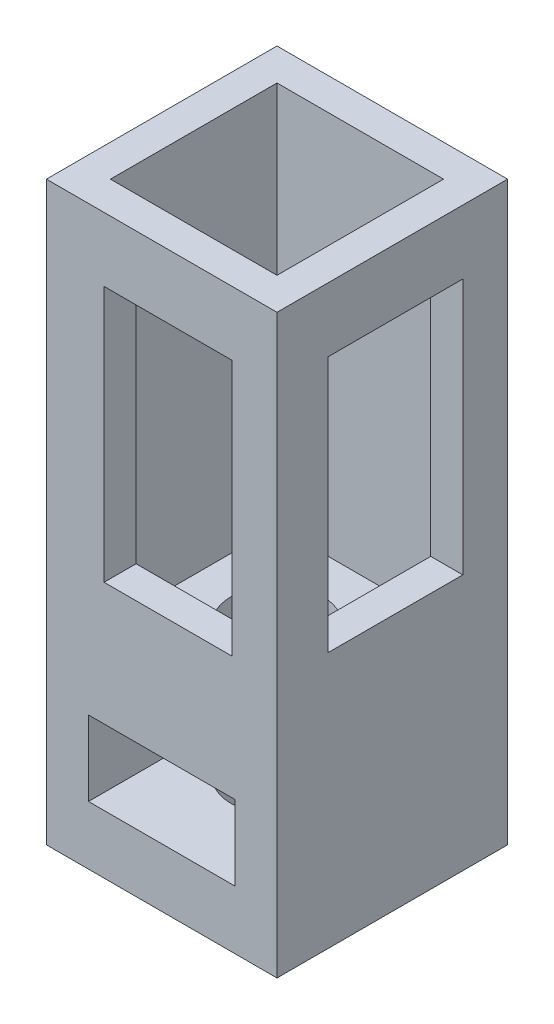
from build123d import *

# Parameters (mm, degrees)
SKETCH1_W                   = 18
SKETCH1_H                   = 18
BOSS_EXTRUDE1_DEPTH         = 35
SKETCH5_W                   = 13
SKETCH5_H                   = 13
CUT_EXTRUDE1_DEPTH          = 30
CUT_EXTRUDE3_REACH          = 45.278
SKETCH7_W                   = 10.5
SKETCH7_H                   = 20
SKETCH8_W                   = 18
SKETCH8_H                   = 18
BOSS_EXTRUDE2_DEPTH         = 10
SKETCH9_W                   = 11.43
SKETCH9_H                   = 5.85
CUT_EXTRUDE4_DEPTH          = 44.278170017
F_1_4_CLEARANCE_HOLE1_D     = 7.14248
F_1_4_CLEARANCE_HOLE1_DEPTH = 15
F_1_4_CLEARANCE_HOLE1_TIP   = 2.145817477
CUT_EXTRUDE5_REACH          = 45.278
SKETCH12_W                  = 10
SKETCH12_H                  = 20


with BuildPart() as part:
    # Sketch1 → Boss-Extrude1 (new body)
    with BuildSketch(Plane(origin=(0, 0, 0), x_dir=(1, 0, 0), z_dir=(0, 1, 0))):
        with Locations((9, 9)):
            Rectangle(SKETCH1_W, SKETCH1_H)
    extrude(amount=BOSS_EXTRUDE1_DEPTH)

    # Sketch5 → Cut-Extrude1 (cut)
    with BuildSketch(Plane(origin=(0, 35, 0), x_dir=(1, 0, 0), z_dir=(0, 1, 0))):
        with Locations((9, 9)):
            Rectangle(SKETCH5_W, SKETCH5_H)
    extrude(amount=-CUT_EXTRUDE1_DEPTH, mode=Mode.SUBTRACT)

    # Sketch7 → Cut-Extrude3 (cut, up to next)
    with BuildSketch(Plane(origin=(18, 0, 0), x_dir=(0, 0, -1), z_dir=(1, 0, 0)), mode=Mode.PRIVATE) as cut_extrude3_sk1:
        with Locations((9.25, 20)):
            Rectangle(SKETCH7_W, SKETCH7_H)
    cut_extrude3_tool1 = extrude(cut_extrude3_sk1.sketch, amount=-CUT_EXTRUDE3_REACH, mode=Mode.PRIVATE) & part.part
    add(cut_extrude3_tool1.solids().sort_by_distance((18, 20, -9.25))[0], mode=Mode.SUBTRACT)

    # Sketch8 → Boss-Extrude2 (add)
    with BuildSketch(Plane.XZ):
        with Locations((9, -9)):
            Rectangle(SKETCH8_W, SKETCH8_H)
    extrude(amount=BOSS_EXTRUDE2_DEPTH)

    # Sketch9 → Cut-Extrude4 (cut, through all)
    with BuildSketch(Plane.XY):
        with Locations((9, -2.5)):
            Rectangle(SKETCH9_W, SKETCH9_H)
    extrude(amount=-CUT_EXTRUDE4_DEPTH, mode=Mode.SUBTRACT)

    # 1/4 Clearance Hole1
    with Locations(Plane(origin=(0, -10, 0), x_dir=(-1, 0, 0), z_dir=(0, -1, 0))):
        with Locations((-9, 9)):
            Hole(F_1_4_CLEARANCE_HOLE1_D / 2, depth=F_1_4_CLEARANCE_HOLE1_DEPTH)
            with Locations((0, 0, -(F_1_4_CLEARANCE_HOLE1_DEPTH + F_1_4_CLEARANCE_HOLE1_TIP / 2))):  # 118° drill point
                Cone(0, F_1_4_CLEARANCE_HOLE1_D / 2, F_1_4_CLEARANCE_HOLE1_TIP, mode=Mode.SUBTRACT)

    # Sketch12 → Cut-Extrude5 (cut, up to next)
    with BuildSketch(Plane.XY, mode=Mode.PRIVATE) as cut_extrude5_sk1:
        with Locations((9.5, 20)):
            Rectangle(SKETCH12_W, SKETCH12_H)
    cut_extrude5_tool1 = extrude(cut_extrude5_sk1.sketch, amount=-CUT_EXTRUDE5_REACH, mode=Mode.PRIVATE) & part.part
    add(cut_extrude5_tool1.solids().sort_by_distance((9.5, 20, 0))[0], mode=Mode.SUBTRACT)


solid = part.part
